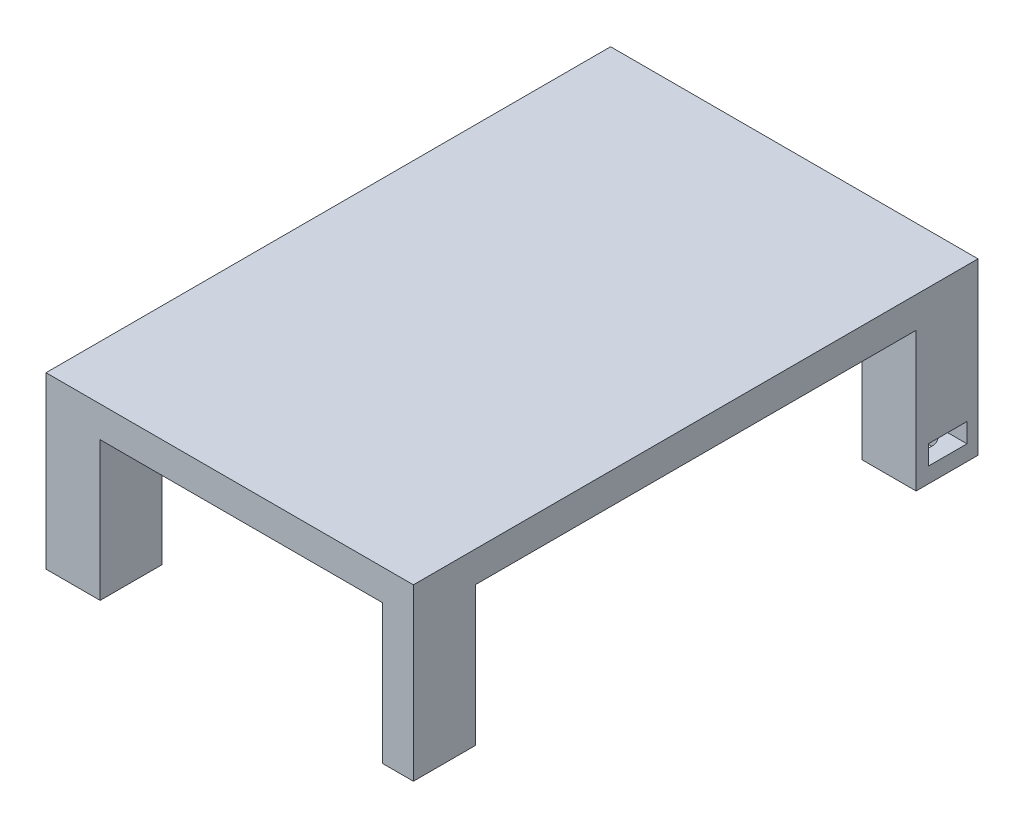
from build123d import *

# Parameters (mm, degrees)
SKETCH1_W           = 47.5
SKETCH1_H           = 73
BOSS_EXTRUDE1_DEPTH = 22
CUT_EXTRUDE1_DEPTH  = 18
SKETCH4_R           = 2
CUT_EXTRUDE2_DEPTH  = 18
SKETCH5_W           = 5
SKETCH5_H           = 2.5
CUT_EXTRUDE3_DEPTH  = 6.5
SKETCH9_W           = 5
SKETCH9_H           = 2.5
CUT_EXTRUDE4_DEPTH  = 6.5


with BuildPart() as part:
    # Sketch1 → Boss-Extrude1 (new body)
    with BuildSketch(Plane(origin=(0, 0, 0), x_dir=(1, 0, 0), z_dir=(0, 1, 0))):
        with Locations((-33.624481527, 0.818123821)):
            Rectangle(SKETCH1_W, SKETCH1_H)
    extrude(amount=BOSS_EXTRUDE1_DEPTH)

    # Sketch2 → Cut-Extrude1 (cut)
    with BuildSketch(Plane.XZ):
        Polygon((-57.374481527, 27.681876179), (-50.374481527, 27.681876179), (-50.374481527, 35.681876179), (-13.874481527, 35.681876179), (-13.874481527, 27.681876179), (-9.874481527, 27.681876179), (-9.874481527, -29.318123821), (-16.874481527, -29.318123821), (-16.874481527, -37.318123821), (-53.374481527, -37.318123821), (-53.374481527, -29.318123821), (-57.374481527, -29.318123821), align=None)
    extrude(amount=-CUT_EXTRUDE1_DEPTH, mode=Mode.SUBTRACT)

    # Sketch4 → Cut-Extrude2 (cut)
    with BuildSketch(Plane.XZ):
        with Locations(Location((-53.374481527, 31.681876179, 0), (0, 0, 270))):
            Circle(SKETCH4_R)
        with Locations(Location((-13.874481527, -33.318123821, 0), (0, 0, 270))):
            Circle(SKETCH4_R)
    extrude(amount=-CUT_EXTRUDE2_DEPTH, mode=Mode.SUBTRACT)

    # Sketch5 → Cut-Extrude3 (cut)
    with BuildSketch(Plane.ZY.offset(57.374481527)):
        with Locations((31.798626617, 3.25)):
            Rectangle(SKETCH5_W, SKETCH5_H)
    extrude(amount=-CUT_EXTRUDE3_DEPTH, mode=Mode.SUBTRACT)

    # Sketch9 → Cut-Extrude4 (cut)
    with BuildSketch(Plane(origin=(-9.874481527, 0, 0), x_dir=(0, 0, -1), z_dir=(1, 0, 0))):
        with Locations((33.394669179, 3.25)):
            Rectangle(SKETCH9_W, SKETCH9_H)
    extrude(amount=-CUT_EXTRUDE4_DEPTH, mode=Mode.SUBTRACT)


solid = part.part
